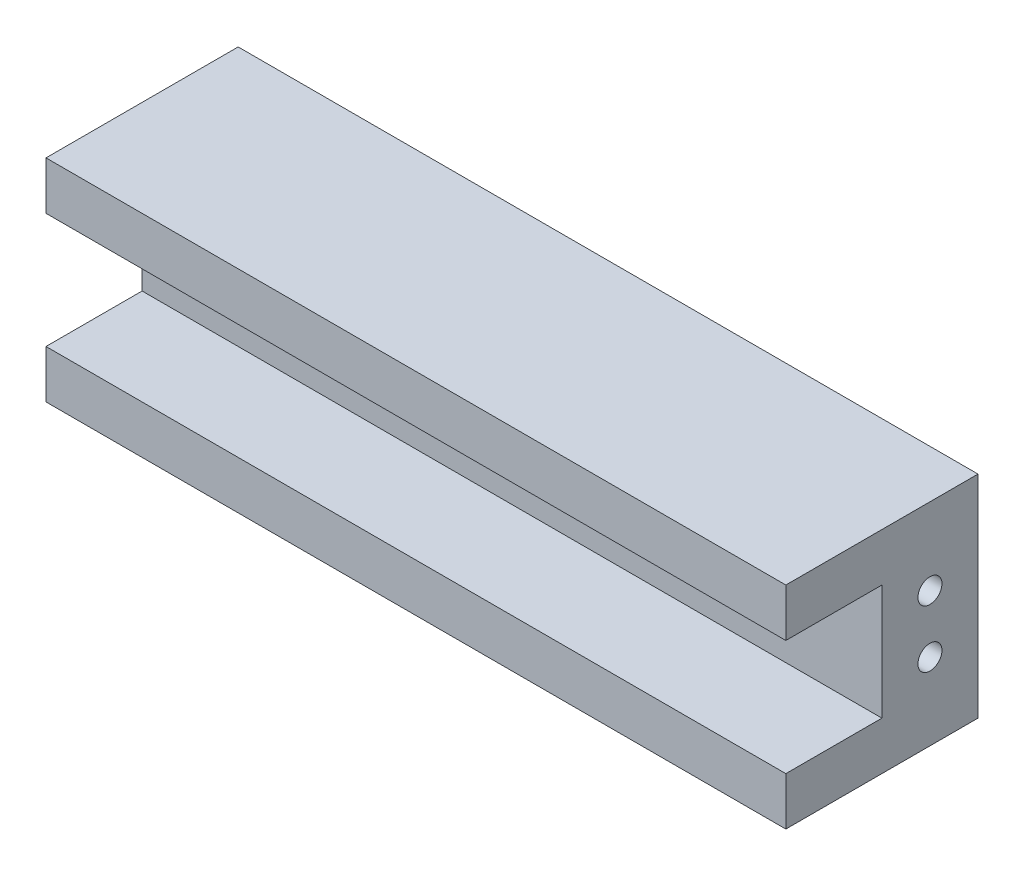
from build123d import *

# Parameters (mm, degrees)
SKETCH1_W           = 77
SKETCH1_H           = 12
BOSS_EXTRUDE1_DEPTH = 10
SKETCH2_R           = 1.25
CUT_EXTRUDE1_DEPTH  = 12
SKETCH3_W           = 77
SKETCH3_H           = 20
BOSS_EXTRUDE2_DEPTH = 5


with BuildPart() as part:
    # Sketch1 → Boss-Extrude1 (new body)
    with BuildSketch(Plane.XY):
        with Locations((38.5, 6)):
            Rectangle(SKETCH1_W, SKETCH1_H)
    extrude(amount=BOSS_EXTRUDE1_DEPTH)

    # Sketch2 → Cut-Extrude1 (cut)
    with BuildSketch(Plane(origin=(77, 0, 0), x_dir=(0, 0, -1), z_dir=(1, 0, 0))):
        with Locations((-5, 3)):
            Circle(SKETCH2_R)
        with Locations((-5, 9)):
            Circle(SKETCH2_R)
    cut_extrude1 = extrude(amount=-CUT_EXTRUDE1_DEPTH, mode=Mode.SUBTRACT)

    # Mirror1: Cut-Extrude1 across plane
    add(cut_extrude1.mirror(Plane.ZY.offset(-38.5)), mode=Mode.SUBTRACT)

    # Sketch3 → Boss-Extrude2 (add)
    with BuildSketch(Plane(origin=(0, 12, 0), x_dir=(1, 0, 0), z_dir=(0, 1, 0))):
        with Locations((38.5, -10)):
            Rectangle(SKETCH3_W, SKETCH3_H)
    boss_extrude2 = extrude(amount=BOSS_EXTRUDE2_DEPTH)

    # Mirror2: Boss-Extrude2 across plane
    add(boss_extrude2.mirror(Plane(origin=(0, 6, 0), x_dir=(0, 0, 1), z_dir=(0, -1, 0))))


solid = part.part
